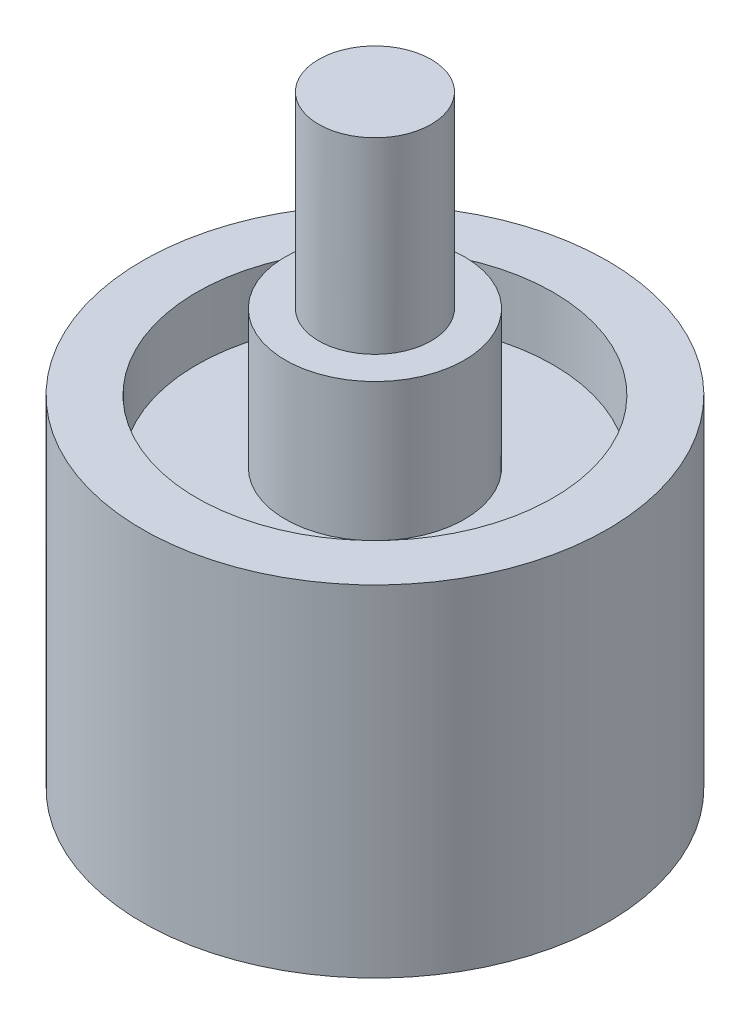
from build123d import *

# Parameters (mm, degrees)
SKETCH1_R                = 3
BOSS_EXTRUDE1_DEPTH      = 10
SKETCH2_R                = 4.775
BOSS_EXTRUDE2_DEPTH      = 10.35
BOSS_EXTRUDE3_DEPTH      = 3
BOSS_EXTRUDE3_DEPTH_BACK = 3
SKETCH3_R                = 9.5
SKETCH4_R                = 12.4
SKETCH4_R_2              = 9.5
BOSS_EXTRUDE4_DEPTH      = 9.35
BOSS_EXTRUDE5_START      = 8.8
SKETCH5_R                = 12.4
SKETCH5_R_2              = 9.5
BOSS_EXTRUDE5_DEPTH      = 8.8


with BuildPart() as part:
    # Sketch1 → Boss-Extrude1 (new body)
    with BuildSketch(Plane(origin=(0, 0, 0), x_dir=(1, 0, 0), z_dir=(0, 1, 0))):
        with Locations(Location((0, 0, 0), (0, 0, 270))):
            Circle(SKETCH1_R)
    extrude(amount=BOSS_EXTRUDE1_DEPTH)

    # Sketch2 → Boss-Extrude2 (add)
    with BuildSketch(Plane.XZ):
        with Locations(Location((0, 0, 0), (0, 0, 270))):
            Circle(SKETCH2_R)
    extrude(amount=BOSS_EXTRUDE2_DEPTH)

    # Sketch3 → Boss-Extrude3 (add, two sides: drawn at the far end of the back side and taken through both)
    with BuildSketch(Plane.XZ.offset(10.35).offset(-BOSS_EXTRUDE3_DEPTH_BACK)):
        with Locations(Location((0, 0, 0), (0, 0, 270))):
            Circle(SKETCH3_R)
    extrude(amount=BOSS_EXTRUDE3_DEPTH + BOSS_EXTRUDE3_DEPTH_BACK)

    # Sketch4 → Boss-Extrude4 (add)
    with BuildSketch(Plane.XZ.offset(13.35)):
        with Locations(Location((0, 0, 0), (0, 0, 270))):
            Circle(SKETCH4_R)
        with Locations(Location((0, 0, 0), (0, 0, 270))):
            Circle(SKETCH4_R_2, mode=Mode.SUBTRACT)
    extrude(amount=-BOSS_EXTRUDE4_DEPTH)

    # Sketch5 → Boss-Extrude5 (add)
    with BuildSketch(Plane.XZ.offset(13.35).offset(BOSS_EXTRUDE5_START)):
        with Locations(Location((0, 0, 0), (0, 0, 270))):
            Circle(SKETCH5_R)
        with Locations(Location((0, 0, 0), (0, 0, 270))):
            Circle(SKETCH5_R_2, mode=Mode.SUBTRACT)
    extrude(amount=-BOSS_EXTRUDE5_DEPTH)


solid = part.part
